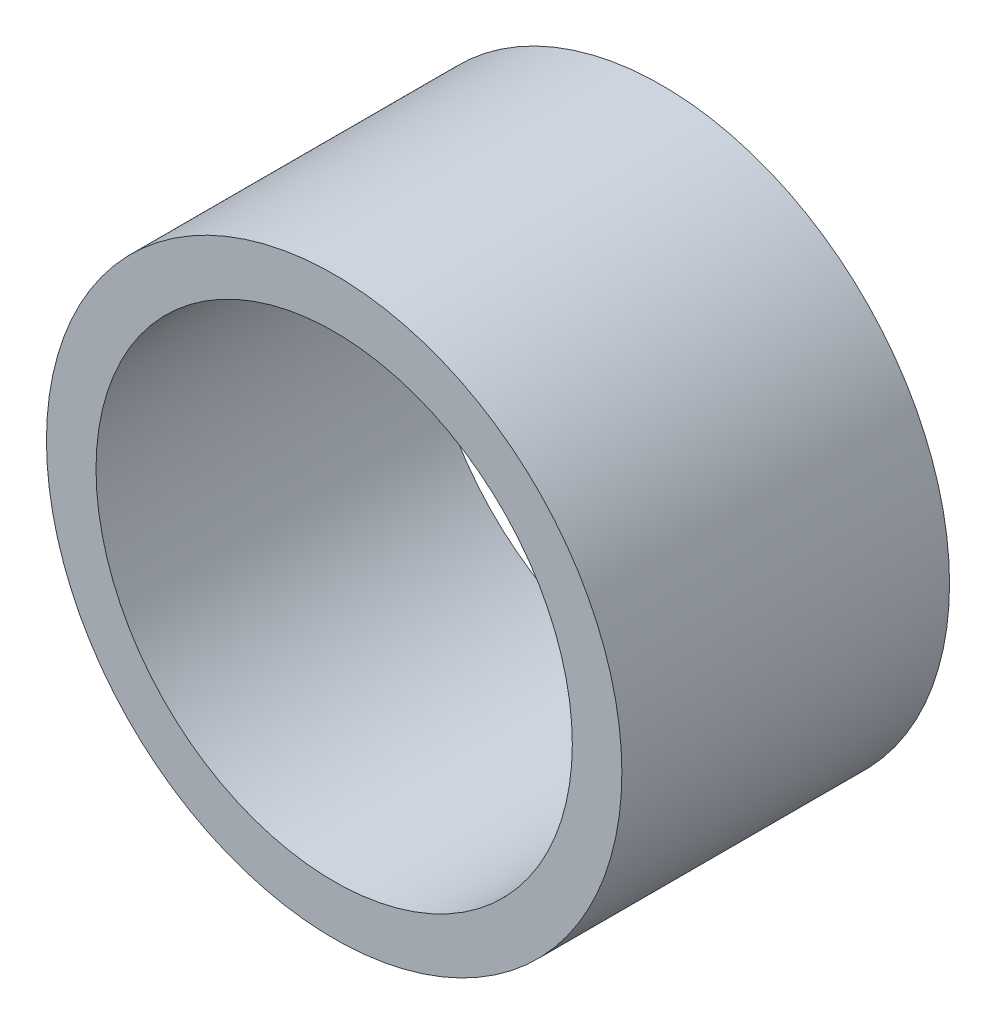
from build123d import *

# Parameters (mm, degrees)
SKETCH1_R           = 36
SKETCH1_R_2         = 29.8
BOSS_EXTRUDE1_DEPTH = 41


with BuildPart() as part:
    # Sketch1 → Boss-Extrude1 (new body)
    with BuildSketch(Plane.XY):
        Circle(SKETCH1_R)
        Circle(SKETCH1_R_2, mode=Mode.SUBTRACT)
    extrude(amount=BOSS_EXTRUDE1_DEPTH)


solid = part.part
